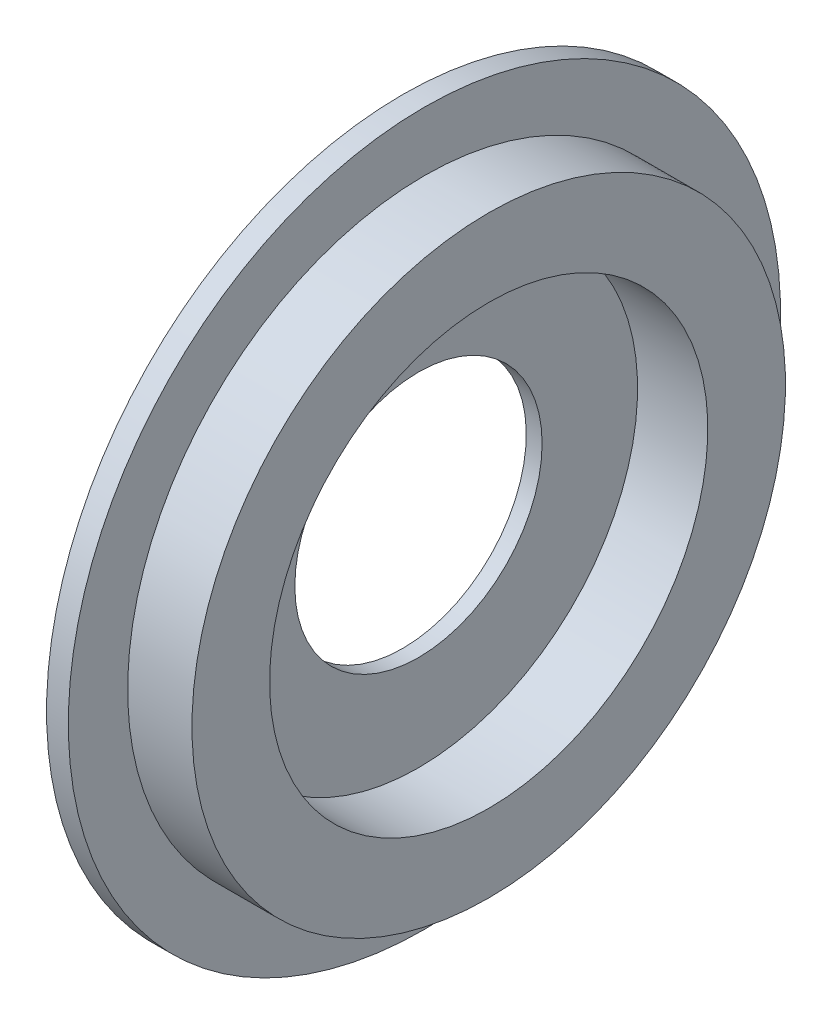
from build123d import *

# Parameters (mm, degrees)
SKIZZE2_R                       = 6.25
SCHNITT_LINEAR_AUSTRAGEN1_DEPTH = 26.824842691


with BuildPart() as part:
    # Skizze1 → Rotation2 (revolve)
    with BuildSketch(Plane.XY):
        Polygon((0, 0), (0, 18), (1.1, 18), (1.1, 15), (4.35, 15), (4.35, 11.075), (0.8, 11.075), (0.8, 0), align=None)
    revolve(axis=Axis((0.8, 0, 0), (-1, 0, 0)))

    # Skizze2 → Schnitt-Linear austragen1 (cut, through all)
    with BuildSketch(Plane.ZY):
        with Locations(Location((0, 0, 0), (0, 0, 270))):
            Circle(SKIZZE2_R)
    extrude(amount=-SCHNITT_LINEAR_AUSTRAGEN1_DEPTH, mode=Mode.SUBTRACT)


solid = part.part
